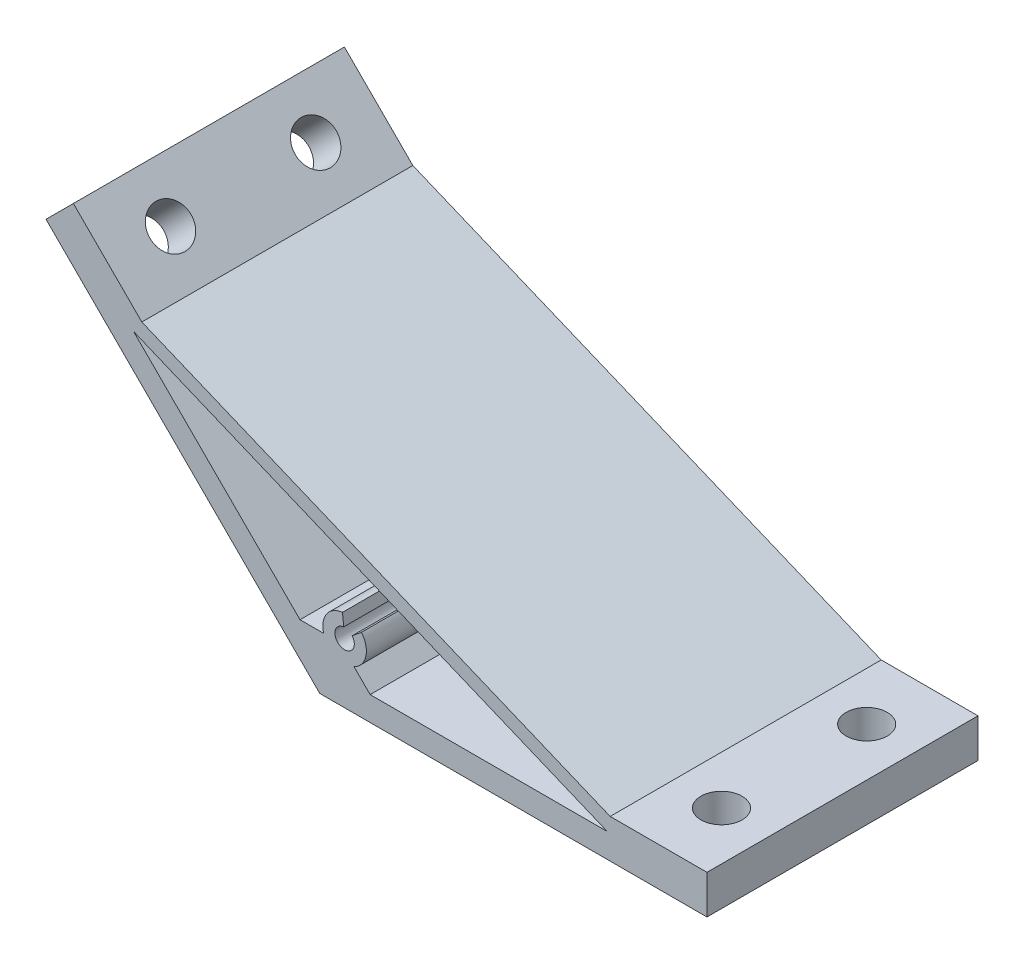
from build123d import *

# Parameters (mm, degrees)
EXTRUDE_1_DEPTH         = 28
HOLE_WIZARD_8_5_8_5_1_D = 8.5


with BuildPart() as part:
    # 草图1 → 凸台-拉伸1 (new, symmetric)
    with BuildSketch(Plane.XY):
        Polygon((6936.119122288, -1232.086390659), (6992.687664783, -1288.654933154), (7072.687664783, -1288.654933154), (7072.687664783, -1280.654933154), (7052.687664783, -1280.654933154), (6955.918112162, -1240.571672033), (6941.775976538, -1226.429536409), align=None)
        with BuildLine():
            Line((7009.090927681, -1283.654933154), (7003.090927681, -1283.654933154))
            Line((7003.090927681, -1283.654933154), (6999.760549745, -1280.324555218))
            ThreePointArc((6999.760549745, -1280.324555218), (7002.213755914, -1277.239517812), (7001.296666197, -1273.406161221))
            Line((7001.296666197, -1273.406161221), (6999.365595427, -1274.993916141))
            ThreePointArc((6999.365595427, -1274.993916141), (6997.055371947, -1278.111879141), (6997.626530039, -1274.273571671))
            Line((6997.626530039, -1274.273571671), (6997.383769074, -1271.785386165))
            ThreePointArc((6997.383769074, -1271.785386165), (6994.101203016, -1273.731324494), (6993.49338103, -1277.49861375))
            Line((6993.49338103, -1277.49861375), (6988.602413191, -1277.49861375))
            Line((6988.602413191, -1277.49861375), (6954.21874867, -1243.114949228))
            Line((6954.21874867, -1243.114949228), (7052.090927681, -1283.654933154))
            Line((7052.090927681, -1283.654933154), (7029.403393536, -1283.654933154))
            Line((7029.403393536, -1283.654933154), (7009.090927681, -1283.654933154))
        make_face(mode=Mode.SUBTRACT)
    extrude(amount=EXTRUDE_1_DEPTH, both=True)

    # Ø8.5 (8.5) 直径孔1 (through all)
    with Locations(Plane(origin=(2852.016365815, 2852.016365815, 0), x_dir=(0.7071067811865628, -0.7071067811865324, 0), z_dir=(-0.7071067811865324, -0.7071067811865628, 0))):
        with Locations((5785.79350833, -15), (5785.79350833, 15)):
            hole_wizard_8_5_8_5_1 = Hole(HOLE_WIZARD_8_5_8_5_1_D / 2)

    # 镜向1: Ø8.5 (8.5) 直径孔1 across plane
    add(hole_wizard_8_5_8_5_1.mirror(Plane(origin=(6424.240586557, -2661.0075789, 0), x_dir=(0, 0, 1), z_dir=(-0.9238795325112645, 0.3826834323651437, 0))), mode=Mode.SUBTRACT)


solid = part.part
